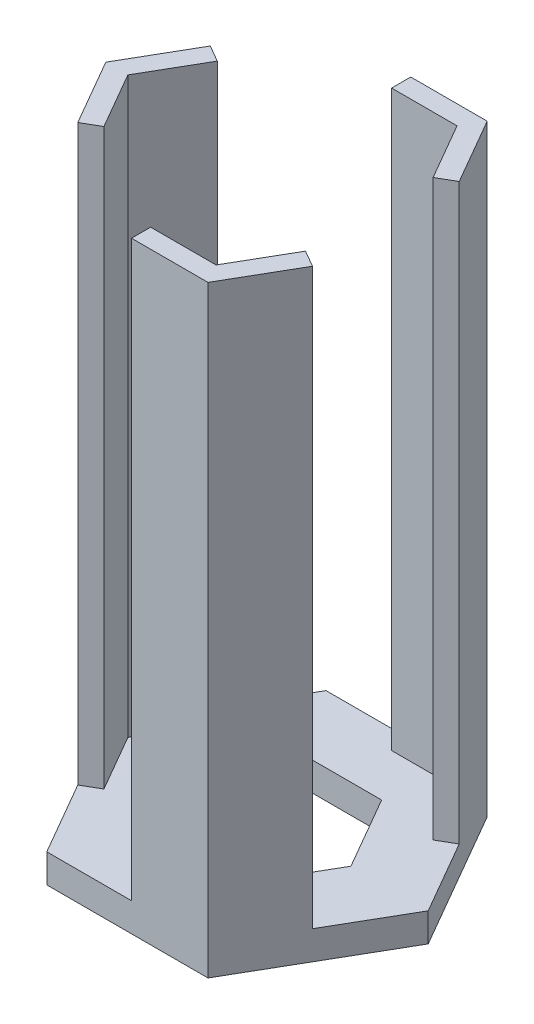
from build123d import *

# Parameters (mm, degrees)
EXTRUDE_1_DEPTH = 3
EXTRUDE_START   = -3
EXTRUDE_2_DEPTH = 63
EXTRUDE_3_DEPTH = 3


with BuildPart() as part:
    # 草图1 → 凸台-拉伸1 (new body)
    with BuildSketch(Plane(origin=(0, 0, 0), x_dir=(1, 0, 0), z_dir=(0, 1, 0))):
        Polygon((14.549226784, 0), (7.274613392, 12.6), (-7.274613392, 12.6), (-14.549226784, 0), (-7.274613392, -12.6), (7.274613392, -12.6), align=None)
        Polygon((-8.775724092, 0), (-4.387862046, -7.6), (4.387862046, -7.6), (8.775724092, 0), (4.387862046, 7.6), (-4.387862046, 7.6), align=None, mode=Mode.SUBTRACT)
    extrude(amount=EXTRUDE_1_DEPTH)

    # 草图2 → 凸台-拉伸2 (add)
    with BuildSketch(Plane(origin=(0, 3, 0), x_dir=(1, 0, 0), z_dir=(0, 1, 0)).offset(EXTRUDE_START)):
        Polygon((-12.85862786, 6.92820323), (-16.85862786, 0), (-12.85862786, -6.92820323), (-11.126577053, -5.92820323), (-14.549226784, 0), (-11.126577053, 5.92820323), align=None)
        Polygon((8.42931393, 14.6), (0.42931393, 14.6), (0.42931393, 12.6), (7.274613392, 12.6), (10.697263123, 6.67179677), (12.42931393, 7.67179677), align=None)
        Polygon((0.42931393, -12.6), (0.42931393, -14.6), (8.42931393, -14.6), (12.42931393, -7.67179677), (10.697263123, -6.67179677), (7.274613392, -12.6), align=None)
    extrude(amount=EXTRUDE_2_DEPTH)

    # 草图2<3> → 凸台-拉伸3 (add)
    with BuildSketch(Plane(origin=(0, 3, 0), x_dir=(1, 0, 0), z_dir=(0, 1, 0))):
        Polygon((-8.42931393, 14.6), (-12.85862786, 6.92820323), (-11.126577053, 5.92820323), (-7.274613392, 12.6), (0.42931393, 12.6), (0.42931393, 14.6), align=None)
        Polygon((10.697263123, -6.67179677), (12.42931393, -7.67179677), (16.85862786, 0), (12.42931393, 7.67179677), (10.697263123, 6.67179677), (14.549226784, 0), align=None)
        Polygon((-11.126577053, -5.92820323), (-12.85862786, -6.92820323), (-8.42931393, -14.6), (0.42931393, -14.6), (0.42931393, -12.6), (-7.274613392, -12.6), align=None)
    extrude(amount=-EXTRUDE_3_DEPTH)


solid = part.part
